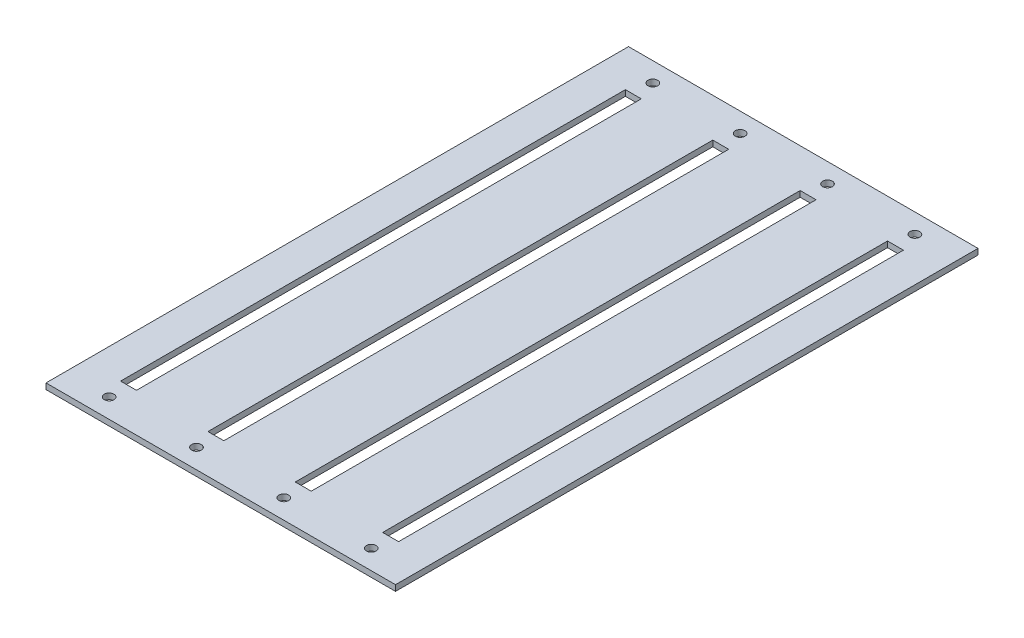
from build123d import *

# Parameters (mm, degrees)
SKETCH2_W           = 180
SKETCH2_H           = 300
BOSS_EXTRUDE1_DEPTH = 3
SKETCH3_W           = 8.2
SKETCH3_H           = 260
CUT_EXTRUDE1_DEPTH  = 175.954279742
SKETCH4_R           = 2.5
CUT_EXTRUDE2_DEPTH  = 175.954279742


with BuildPart() as part:
    # Sketch2 → Boss-Extrude1 (new body)
    with BuildSketch(Plane(origin=(0, 0, 0), x_dir=(1, 0, 0), z_dir=(0, 1, 0))):
        Rectangle(SKETCH2_W, SKETCH2_H)
    extrude(amount=BOSS_EXTRUDE1_DEPTH)

    # Sketch3 → Cut-Extrude1 (cut, through all)
    with BuildSketch(Plane(origin=(0, 3, 0), x_dir=(1, 0, 0), z_dir=(0, 1, 0))):
        with Locations((-67.5, 0)):
            Rectangle(SKETCH3_W, SKETCH3_H)
        with Locations((-22.5, 0)):
            Rectangle(SKETCH3_W, SKETCH3_H)
        with Locations((22.5, 0)):
            Rectangle(SKETCH3_W, SKETCH3_H)
        with Locations((67.5, 0)):
            Rectangle(SKETCH3_W, SKETCH3_H)
    extrude(amount=-CUT_EXTRUDE1_DEPTH, mode=Mode.SUBTRACT)

    # Sketch4 → Cut-Extrude2 (cut, through all)
    with BuildSketch(Plane(origin=(0, 3, 0), x_dir=(1, 0, 0), z_dir=(0, 1, 0))):
        with Locations(Location((67.5, -140, 0), (0, 0, 270))):
            Circle(SKETCH4_R)
        with Locations(Location((-67.5, -140, 0), (0, 0, 90))):
            Circle(SKETCH4_R)
        with Locations(Location((67.5, 140, 0), (0, 0, 90))):
            Circle(SKETCH4_R)
        with Locations(Location((-67.5, 140, 0), (0, 0, 270))):
            Circle(SKETCH4_R)
        with Locations(Location((-22.5, -140, 0), (0, 0, 270))):
            Circle(SKETCH4_R)
        with Locations(Location((22.5, -140, 0), (0, 0, 90))):
            Circle(SKETCH4_R)
        with Locations(Location((22.5, 140, 0), (0, 0, 270))):
            Circle(SKETCH4_R)
        with Locations(Location((-22.5, 140, 0), (0, 0, 90))):
            Circle(SKETCH4_R)
    extrude(amount=-CUT_EXTRUDE2_DEPTH, mode=Mode.SUBTRACT)


solid = part.part
